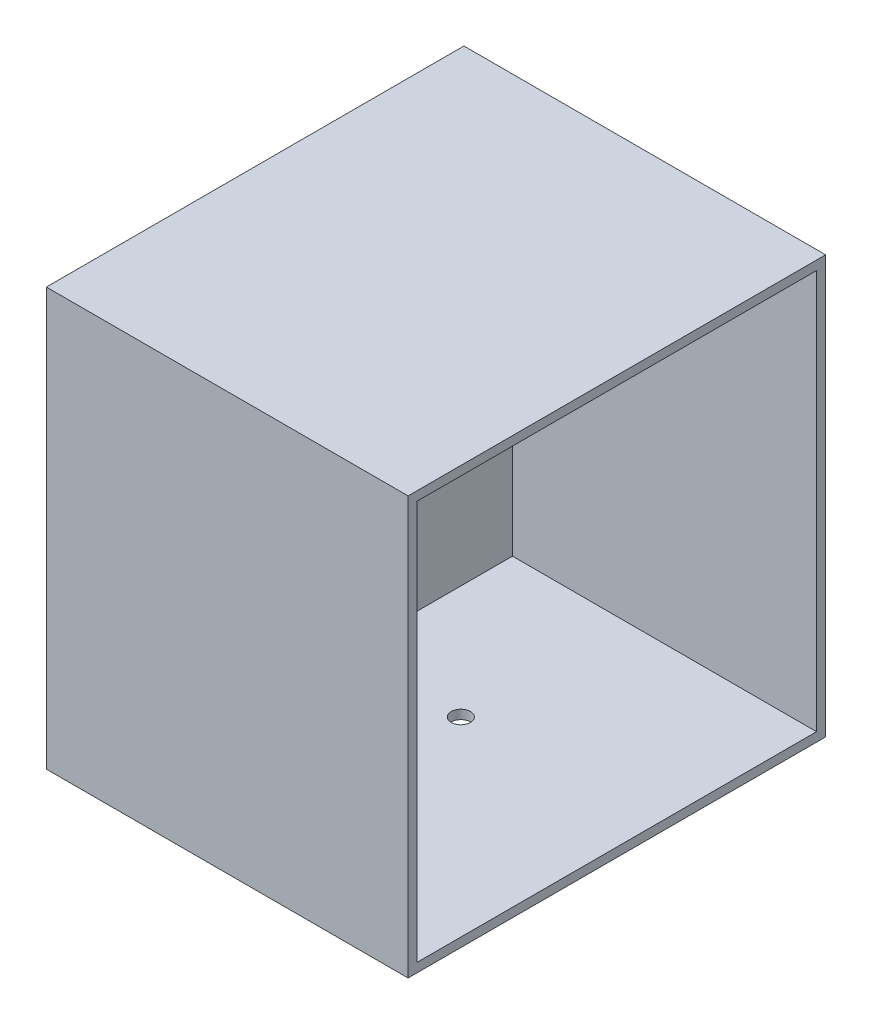
from build123d import *

# Parameters (mm, degrees)
SKETCH1_W                       = 92
SKETCH1_H                       = 92
SKETCH1_W_2                     = 88
SKETCH1_H_2                     = 88
SKETCH1_R                       = 27.305
BOSS_EXTRUDE1_DEPTH             = 12.7
SKETCH2_W                       = 92
SKETCH2_H                       = 92
SKETCH2_W_2                     = 88
SKETCH2_H_2                     = 88
BOSS_EXTRUDE2_DEPTH             = 67
F_19_0_166_DIAMETER_HOLE1_D     = 4.2164
F_19_0_166_DIAMETER_HOLE1_DEPTH = 2


with BuildPart() as part:
    # Sketch1 → Boss-Extrude1 (new body)
    # profile 1 of 2: a face of its own
    with BuildSketch(Plane(origin=(0, 0, 0), x_dir=(0, 0, -1), z_dir=(1, 0, 0))):
        Rectangle(SKETCH1_W, SKETCH1_H)
        Rectangle(SKETCH1_W_2, SKETCH1_H_2, mode=Mode.SUBTRACT)
    # profile 2 of 2: a face of its own
    with BuildSketch(Plane(origin=(0, 0, 0), x_dir=(0, 0, -1), z_dir=(1, 0, 0))):
        Rectangle(SKETCH1_W_2, SKETCH1_H_2)
        Circle(SKETCH1_R, mode=Mode.SUBTRACT)
    extrude(amount=BOSS_EXTRUDE1_DEPTH)

    # Sketch2 → Boss-Extrude2 (add)
    with BuildSketch(Plane(origin=(12.7, 0, 0), x_dir=(0, 0, -1), z_dir=(1, 0, 0))):
        Rectangle(SKETCH2_W, SKETCH2_H)
        Rectangle(SKETCH2_W_2, SKETCH2_H_2, mode=Mode.SUBTRACT)
    extrude(amount=BOSS_EXTRUDE2_DEPTH)

    # #19 (0.166) Diameter Hole1
    with Locations(Plane(origin=(0, -46, 0), x_dir=(-1, 0, 0), z_dir=(0, -1, 0))):
        with Locations((-37.7, 7.62), (-37.7, -7.62), (17.600686592, 72.613770274), (-57.973181852, -74.350642439), (-79.7, -100.115693871), (-40.410274663, -84.366152369)):
            Hole(F_19_0_166_DIAMETER_HOLE1_D / 2, depth=F_19_0_166_DIAMETER_HOLE1_DEPTH)


solid = part.part
